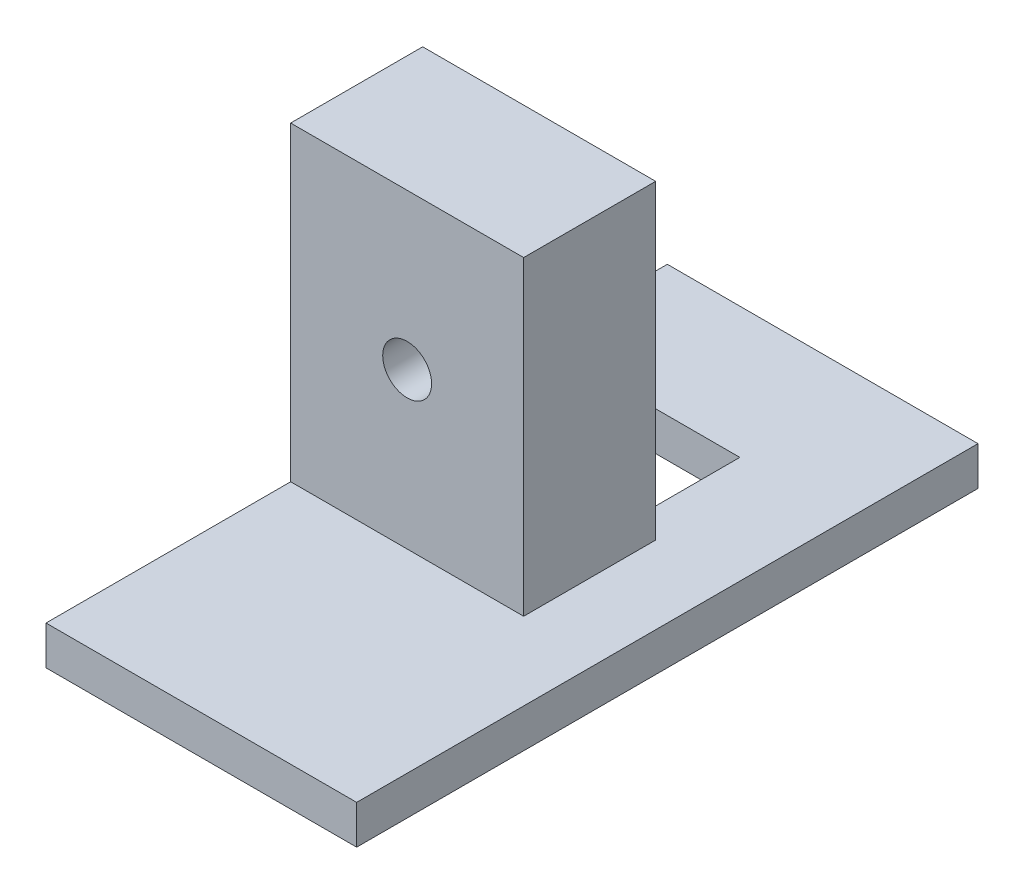
from build123d import *

# Parameters (mm, degrees)
SKETCH2_W           = 50.8
SKETCH2_H           = 101.6
BOSS_EXTRUDE1_DEPTH = 6.35
SKETCH4_W           = 38.1
SKETCH4_H           = 21.59
BOSS_EXTRUDE2_DEPTH = 50.8
SKETCH5_R           = 4
CUT_EXTRUDE1_DEPTH  = 88.779419712
SKETCH6_W           = 28.448
SKETCH6_H           = 15.71752
CUT_EXTRUDE2_DEPTH  = 77.2


with BuildPart() as part:
    # Sketch2 → Boss-Extrude1 (new body)
    with BuildSketch(Plane(origin=(0, 0, 0), x_dir=(1, 0, 0), z_dir=(0, 1, 0))):
        Rectangle(SKETCH2_W, SKETCH2_H)
    extrude(amount=BOSS_EXTRUDE1_DEPTH)

    # Sketch4 → Boss-Extrude2 (add)
    with BuildSketch(Plane(origin=(0, 6.35, 0), x_dir=(1, 0, 0), z_dir=(0, 1, 0))):
        with Locations((-6.35, 0)):
            Rectangle(SKETCH4_W, SKETCH4_H)
    extrude(amount=BOSS_EXTRUDE2_DEPTH)

    # Sketch5 → Cut-Extrude1 (cut, through all)
    with BuildSketch(Plane(origin=(0, 0, -10.795), x_dir=(-1, 0, 0), z_dir=(0, 0, -1))):
        with Locations((6.35, 31.75)):
            Circle(SKETCH5_R)
    extrude(amount=-CUT_EXTRUDE1_DEPTH, mode=Mode.SUBTRACT)

    # Sketch6 → Cut-Extrude2 (cut, through all)
    with BuildSketch(Plane(origin=(0, 6.35, 0), x_dir=(1, 0, 0), z_dir=(0, 1, 0))):
        with Locations((-6.35, 21.52396)):
            Rectangle(SKETCH6_W, SKETCH6_H)
    extrude(amount=-CUT_EXTRUDE2_DEPTH, mode=Mode.SUBTRACT)


solid = part.part
